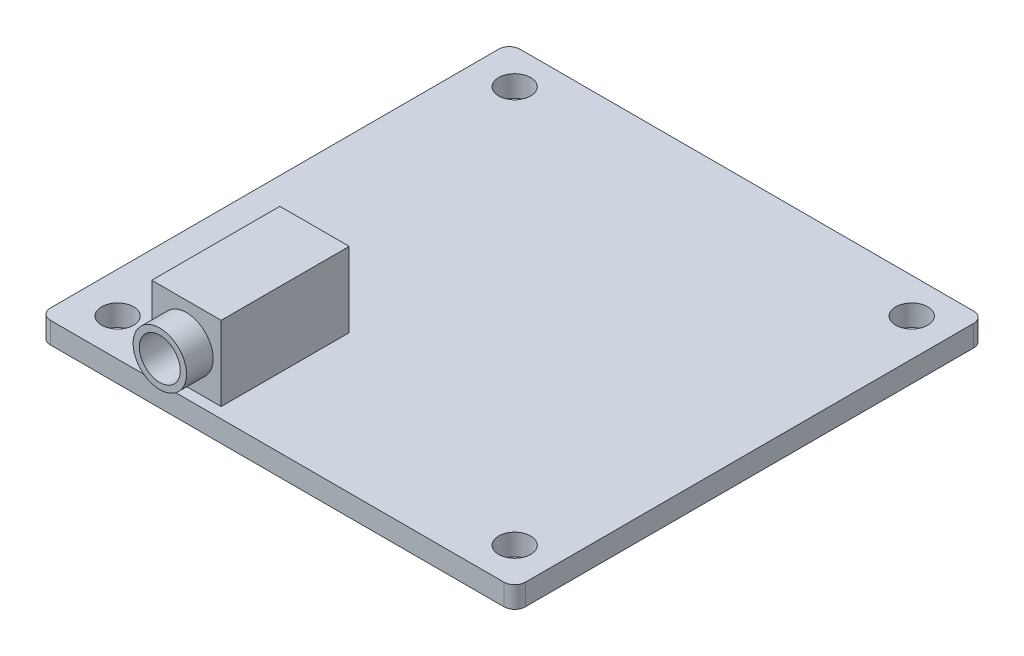
from build123d import *

# Parameters (mm, degrees)
SKETCH1_W           = 44.5
SKETCH1_H           = 44
BOSS_EXTRUDE1_DEPTH = 2
SKETCH2_R           = 1.5
CUT_EXTRUDE1_DEPTH  = 63.611899827
SKETCH3_W           = 6.5
SKETCH3_H           = 12
BOSS_EXTRUDE2_DEPTH = 7
SKETCH4_R           = 2.5
BOSS_EXTRUDE3_DEPTH = 2.5
SKETCH5_R           = 1.920961375
CUT_EXTRUDE2_DEPTH  = 11.5
FILLET1_R           = 1


with BuildPart() as part:
    # Sketch1 → Boss-Extrude1 (new body)
    with BuildSketch(Plane(origin=(0, 0, 0), x_dir=(1, 0, 0), z_dir=(0, 1, 0))):
        with Locations((22.25, 22)):
            Rectangle(SKETCH1_W, SKETCH1_H)
    extrude(amount=BOSS_EXTRUDE1_DEPTH)

    # Sketch2 → Cut-Extrude1 (cut, through all)
    with BuildSketch(Plane(origin=(0, 2, 0), x_dir=(1, 0, 0), z_dir=(0, 1, 0))):
        with Locations(Location((3.8, 40.7, 0), (0, 0, 270))):
            Circle(SKETCH2_R)
        with Locations(Location((3.8, 3.5, 0), (0, 0, 270))):
            Circle(SKETCH2_R)
        with Locations(Location((41, 3.5, 0), (0, 0, 270))):
            Circle(SKETCH2_R)
        with Locations(Location((41, 40.7, 0), (0, 0, 270))):
            Circle(SKETCH2_R)
    extrude(amount=-CUT_EXTRUDE1_DEPTH, mode=Mode.SUBTRACT)

    # Sketch3 → Boss-Extrude2 (add)
    with BuildSketch(Plane(origin=(0, 2, 0), x_dir=(1, 0, 0), z_dir=(0, 1, 0))):
        with Locations((12.75, 7)):
            Rectangle(SKETCH3_W, SKETCH3_H)
    extrude(amount=BOSS_EXTRUDE2_DEPTH)

    # Sketch4 → Boss-Extrude3 (add)
    with BuildSketch(Plane.XY.offset(-1)):
        with Locations(Location((12.75, 5.5, 0), (0, 0, 180))):
            Circle(SKETCH4_R)
    extrude(amount=BOSS_EXTRUDE3_DEPTH)

    # Sketch5 → Cut-Extrude2 (cut)
    with BuildSketch(Plane.XY.offset(1.5)):
        with Locations((12.75, 5.5)):
            Circle(SKETCH5_R)
    extrude(amount=-CUT_EXTRUDE2_DEPTH, mode=Mode.SUBTRACT)

    # Fillet1
    fillet1_edges = [part.edges().sort_by_distance(p)[0] for p in [
        (0, 1, -44),
        (44.5, 1, -44),
        (44.5, 1, 0),
        (0, 1, 0),
    ]]
    fillet(fillet1_edges, radius=FILLET1_R)


solid = part.part
